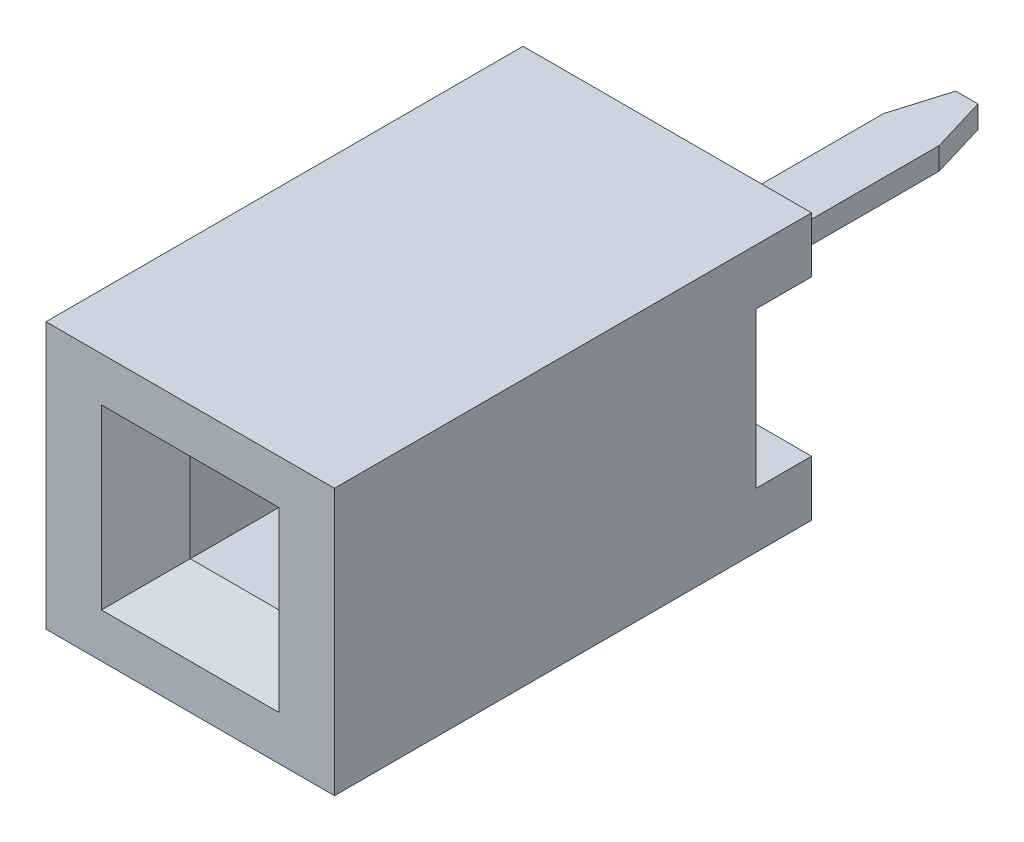
from build123d import *

# Parameters (mm, degrees)
SKETCH1_W           = 2.4
SKETCH1_H           = 4.3
BOSS_EXTRUDE1_DEPTH = 1.3
SKETCH_1_W          = 0.5
SKETCH_1_H          = 1.4
CUT_EXTRUDE_1_DEPTH = 6.166236541
SKETCH2_W           = 0.8
SKETCH2_H           = 0.8
CUT_EXTRUDE1_DEPTH  = 3.1
CHAMFER_1_SIZE      = 0.4
BOSS_EXTRUDE2_DEPTH = 0.1


with BuildPart() as part:
    # Sketch1 → Boss-Extrude1 (new, symmetric)
    with BuildSketch(Plane(origin=(0, 0, 0), x_dir=(0, -1, 0), z_dir=(1, 0, 0))):
        with Locations((0, -2.15)):
            Rectangle(SKETCH1_W, SKETCH1_H)
    extrude(amount=BOSS_EXTRUDE1_DEPTH, both=True)

    # Эскиз1 → Вырез-Вытянуть1 (cut, through all)
    with BuildSketch(Plane(origin=(1.3, 0, 0), x_dir=(0, 0, -1), z_dir=(1, 0, 0))):
        with Locations((-0.25, 0)):
            Rectangle(SKETCH_1_W, SKETCH_1_H)
    extrude(amount=-CUT_EXTRUDE_1_DEPTH, mode=Mode.SUBTRACT)

    # Sketch2 → Cut-Extrude1 (cut)
    with BuildSketch(Plane(origin=(0, 0, 4.3), x_dir=(-1, 0, 0), z_dir=(0, 0, 1))):
        Rectangle(SKETCH2_W, SKETCH2_H)
    extrude(amount=-CUT_EXTRUDE1_DEPTH, mode=Mode.SUBTRACT)

    # Фаска1
    chamfer_1_edges = [part.edges().sort_by_distance(p)[0] for p in [
        (-0.4, 0, 4.3),
        (0, -0.4, 4.3),
        (0.4, 0, 4.3),
        (0, 0.4, 4.3),
    ]]
    chamfer(chamfer_1_edges, length=CHAMFER_1_SIZE)

    # Sketch3 → Boss-Extrude2 (add, symmetric)
    with BuildSketch(Plane(origin=(0, 0, 0), x_dir=(1, 0, 0), z_dir=(0, 1, 0))):
        Polygon((-0.25, 0), (-0.25, 2.2), (-0.1, 2.7), (0.1, 2.7), (0.25, 2.2), (0.25, 0), (0.25, -0.5), (-0.25, -0.5), align=None)
        Polygon((0.4, -1.2), (-0.4, -1.2), (-0.4, -3.1), (-0.3, -3.1), (-0.3, -1.3), (0.3, -1.3), (0.3, -3.1), (0.4, -3.1), align=None)
    extrude(amount=BOSS_EXTRUDE2_DEPTH, both=True)


solid = part.part
